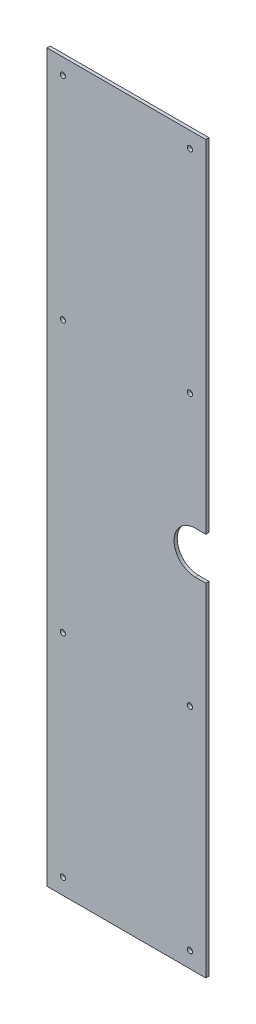
from build123d import *

# Parameters (mm, degrees)
SKETCH1_W               = 686
SKETCH1_H               = 150
SKETCH1_R               = 2.5
BOSS_EXTRUDE1_DEPTH     = 3
CUT_EXTRUDE4_DEPTH      = 352.116789687
CUT_EXTRUDE4_DEPTH_BACK = 10


with BuildPart() as part:
    # Sketch1 → Boss-Extrude1 (new body)
    with BuildSketch(Plane(origin=(0, 0, 0), x_dir=(0, 1, 0), z_dir=(0, 0, 1))):
        Rectangle(SKETCH1_W, SKETCH1_H)
        with Locations(Location((-128, -60, 0), (0, 0, 270))):
            Circle(SKETCH1_R, mode=Mode.SUBTRACT)
        with Locations(Location((-328, 60, 0), (0, 0, 270))):
            Circle(SKETCH1_R, mode=Mode.SUBTRACT)
        with Locations(Location((-328, -60, 0), (0, 0, 270))):
            Circle(SKETCH1_R, mode=Mode.SUBTRACT)
        with Locations(Location((-128, 60, 0), (0, 0, 270))):
            Circle(SKETCH1_R, mode=Mode.SUBTRACT)
        with Locations(Location((328, -60, 0), (0, 0, 270))):
            Circle(SKETCH1_R, mode=Mode.SUBTRACT)
        with Locations(Location((328, 60, 0), (0, 0, 270))):
            Circle(SKETCH1_R, mode=Mode.SUBTRACT)
        with Locations(Location((128, -60, 0), (0, 0, 270))):
            Circle(SKETCH1_R, mode=Mode.SUBTRACT)
        with Locations(Location((128, 60, 0), (0, 0, 270))):
            Circle(SKETCH1_R, mode=Mode.SUBTRACT)
    extrude(amount=BOSS_EXTRUDE1_DEPTH)

    # Sketch4 → Cut-Extrude4 (cut, two sides: drawn at the far end of the back side and taken through both)
    with BuildSketch(Plane.XY.offset(3).offset(-CUT_EXTRUDE4_DEPTH_BACK)):
        with BuildLine():
            Line((75, -20), (75, 20))
            Line((75, 20), (65, 20))
            ThreePointArc((65, 20), (45, 0), (65, -20))
            Line((65, -20), (75, -20))
        make_face()
    extrude(amount=CUT_EXTRUDE4_DEPTH + CUT_EXTRUDE4_DEPTH_BACK, mode=Mode.SUBTRACT)


solid = part.part
